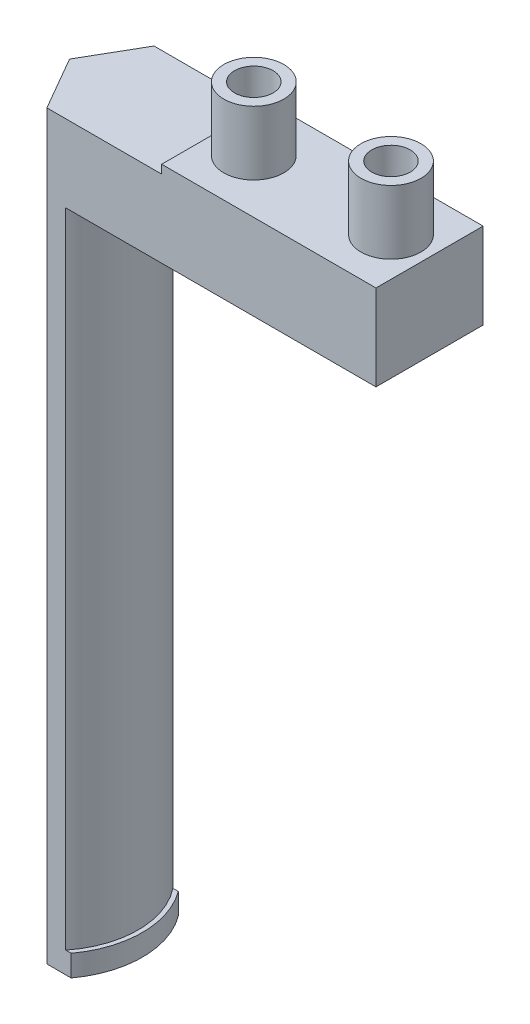
from build123d import *

# Parameters (mm, degrees)
ESTRUSIONE_ESTRUSIONE1_DEPTH                         = 25
SCHIZZO3_R                                           = 7
ESTRUSIONE_ESTRUSIONE2_DEPTH                         = 14.91
FORO_LAMATO_PER_VITE_M8_A_TESTA_CILINDRI_D           = 9
FORO_LAMATO_PER_VITE_M8_A_TESTA_CILINDRI_DEPTH       = 34.91
FORO_LAMATO_PER_VITE_M8_A_TESTA_CILINDRI_CBORE_D     = 15
FORO_LAMATO_PER_VITE_M8_A_TESTA_CILINDRI_CBORE_DEPTH = 8.6
TAGLIO_ESTRUSIONE3_DEPTH                             = 150
TAGLIO_ESTRUSIONE4_DEPTH                             = 30
TAGLIO_ESTRUSIONE5_START                             = -20
TAGLIO_ESTRUSIONE5_DEPTH                             = 20
TAGLIO_ESTRUSIONE6_DEPTH                             = 180
TAGLIO_ESTRUSIONE7_START                             = -5
TAGLIO_ESTRUSIONE7_DEPTH                             = 5
TAGLIO_ESTRUSIONE8_DEPTH                             = 2


with BuildPart() as part:
    # Schizzo2 → Estrusione-Estrusione1 (new body)
    with BuildSketch(Plane.XY):
        Polygon((0, 0), (-88, 0), (-88, -200), (-48, -200), (-48, -170), (-68, -170), (-68, -20), (0, -20), align=None)
    extrude(amount=ESTRUSIONE_ESTRUSIONE1_DEPTH)

    # Schizzo3 → Estrusione-Estrusione2 (add)
    with BuildSketch(Plane(origin=(0, 0, 0), x_dir=(1, 0, 0), z_dir=(0, 1, 0))):
        with Locations(Location((-41, -12.5, 0), (0, 0, 180))):
            Circle(SCHIZZO3_R)
        with Locations((-9, -12.5)):
            Circle(SCHIZZO3_R)
    extrude(amount=ESTRUSIONE_ESTRUSIONE2_DEPTH)

    # Foro lamato per Vite M8 a testa cilindrica-1
    with Locations(Plane(origin=(0, -20, 0), x_dir=(-1, 0, 0), z_dir=(0, -1, 0))):
        with Locations((9, -12.5), (41, -12.5)):
            CounterBoreHole(FORO_LAMATO_PER_VITE_M8_A_TESTA_CILINDRI_D / 2, FORO_LAMATO_PER_VITE_M8_A_TESTA_CILINDRI_CBORE_D / 2, FORO_LAMATO_PER_VITE_M8_A_TESTA_CILINDRI_CBORE_DEPTH, depth=FORO_LAMATO_PER_VITE_M8_A_TESTA_CILINDRI_DEPTH)

    # Schizzo10 → Taglio-Estrusione3 (cut)
    with BuildSketch(Plane(origin=(0, -170, 0), x_dir=(1, 0, 0), z_dir=(0, 1, 0))):
        with BuildLine():
            Line((-68, 0), (-72.387505004, 0))
            ThreePointArc((-72.387505004, 0), (-69.128726859, -5.876175573), (-68, -12.5))
            Line((-68, -12.5), (-68, 0))
        make_face()
        with BuildLine():
            Line((-68, -25), (-68, -12.5))
            ThreePointArc((-68, -12.5), (-69.128726859, -19.123824427), (-72.387505004, -25))
            Line((-72.387505004, -25), (-68, -25))
        make_face()
    extrude(amount=TAGLIO_ESTRUSIONE3_DEPTH, mode=Mode.SUBTRACT)

    # Schizzo11 → Taglio-Estrusione4 (cut)
    with BuildSketch(Plane(origin=(0, -170, 0), x_dir=(1, 0, 0), z_dir=(0, 1, 0))):
        with BuildLine():
            Line((-48, -25), (-48, 0))
            Line((-48, 0), (-71.125462969, 0))
            ThreePointArc((-71.125462969, 0), (-70.769833543, -0.494944237), (-70.428716609, -1))
            ThreePointArc((-70.428716609, -1), (-67, -12.5), (-70.428716609, -24))
            ThreePointArc((-70.428716609, -24), (-70.769833543, -24.505055763), (-71.125462969, -25))
            Line((-71.125462969, -25), (-48, -25))
        make_face()
    extrude(amount=-TAGLIO_ESTRUSIONE4_DEPTH, mode=Mode.SUBTRACT)

    # Schizzo12 → Taglio-Estrusione5 (cut)
    with BuildSketch(Plane.XZ.offset(200).offset(TAGLIO_ESTRUSIONE5_START)):
        with BuildLine():
            Line((-71.125462969, 25), (-88, 25))
            Line((-88, 25), (-88, 0))
            Line((-88, 0), (-71.125462969, 0))
            ThreePointArc((-71.125462969, 0), (-67, 12.5), (-71.125462969, 25))
        make_face()
    extrude(amount=TAGLIO_ESTRUSIONE5_DEPTH, mode=Mode.SUBTRACT)

    # Schizzo13 → Taglio-Estrusione6 (cut)
    with BuildSketch(Plane.XZ.offset(180)):
        Polygon((-88, 25), (-88, 12.5), (-84, 12.5), (-76.783121635, 25), align=None)
        Polygon((-84, 12.5), (-88, 12.5), (-88, 0), (-76.783121635, 0), align=None)
    extrude(amount=-TAGLIO_ESTRUSIONE6_DEPTH, mode=Mode.SUBTRACT)

    # Schizzo14 → Taglio-Estrusione7 (cut)
    with BuildSketch(Plane.XZ.offset(180).offset(TAGLIO_ESTRUSIONE7_START)):
        with BuildLine():
            Line((-76.783121635, 25), (-84, 12.5))
            Line((-84, 12.5), (-76.783121635, 0))
            Line((-76.783121635, 0), (-71.125462969, 0))
            ThreePointArc((-71.125462969, 0), (-67, 12.5), (-71.125462969, 25))
            Line((-71.125462969, 25), (-76.783121635, 25))
        make_face()
    extrude(amount=TAGLIO_ESTRUSIONE7_DEPTH, mode=Mode.SUBTRACT)

    # Schizzo15 → Taglio-Estrusione8 (cut)
    with BuildSketch(Plane(origin=(0, 0, 0), x_dir=(1, 0, 0), z_dir=(0, 1, 0))):
        Polygon((-76.783121635, -25), (-50, -25), (-50, 0), (-76.783121635, 0), (-84, -12.5), align=None)
    extrude(amount=-TAGLIO_ESTRUSIONE8_DEPTH, mode=Mode.SUBTRACT)


solid = part.part
